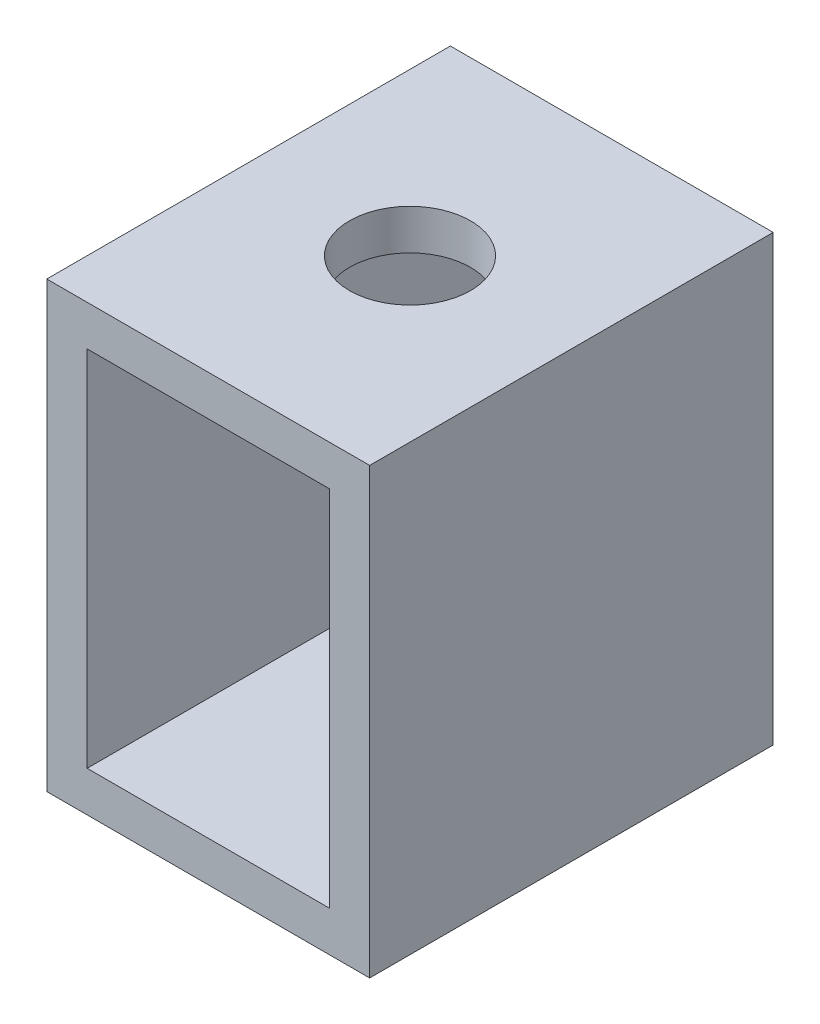
from build123d import *

# Parameters (mm, degrees)
SKETCH1_W           = 4
SKETCH1_H           = 5.5
SKETCH1_W_2         = 3
SKETCH1_H_2         = 4.5
EXTRUDE_THIN1_DEPTH = 5
CUT_EXTRUDE1_REACH  = 10.216
SKETCH2_R           = 0.75


with BuildPart() as part:
    # Sketch1 → Extrude-Thin1 (new body)
    with BuildSketch(Plane.XY):
        with Locations((1.5, 2.25)):
            Rectangle(SKETCH1_W, SKETCH1_H)
        with Locations((1.5, 2.25)):
            Rectangle(SKETCH1_W_2, SKETCH1_H_2, mode=Mode.SUBTRACT)
    extrude(amount=EXTRUDE_THIN1_DEPTH)

    # Sketch2 → Cut-Extrude1 (cut, up to next)
    with BuildSketch(Plane(origin=(0, 5, 0), x_dir=(1, 0, 0), z_dir=(0, 1, 0)), mode=Mode.PRIVATE) as cut_extrude1_sk1:
        with Locations(Location((1.5, -2.5, 0), (0, 0, 270))):
            Circle(SKETCH2_R)
    cut_extrude1_tool1 = extrude(cut_extrude1_sk1.sketch, amount=-CUT_EXTRUDE1_REACH, mode=Mode.PRIVATE) & part.part
    add(cut_extrude1_tool1.solids().sort_by_distance((1.5, 5, 2.5))[0], mode=Mode.SUBTRACT)


solid = part.part
